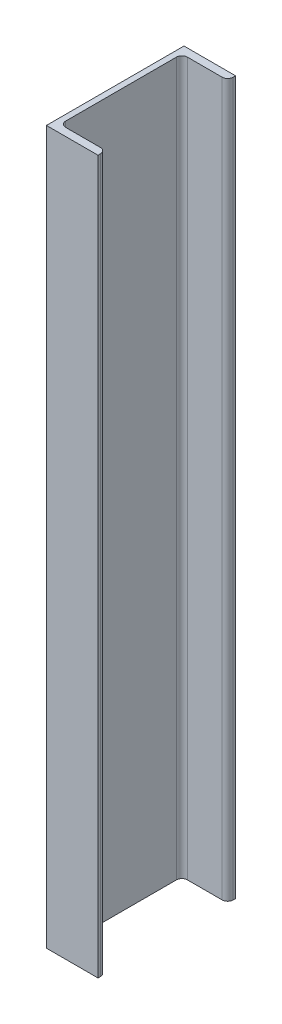
from build123d import *

# Parameters (mm, degrees)
BOSS_EXTRUDE1_DEPTH = 1036


with BuildPart() as part:
    # Sketch1 → Boss-Extrude1 (new body)
    with BuildSketch(Plane(origin=(0, 0, 0), x_dir=(1, 0, 0), z_dir=(0, 1, 0))):
        with BuildLine():
            Line((-38.442622951, 80.983606557), (-113.442622951, 80.983606557))
            Line((-113.442622951, 80.983606557), (-113.442622951, -119.016393443))
            Line((-113.442622951, -119.016393443), (-38.442622951, -119.016393443))
            Line((-38.442622951, -119.016393443), (-38.442622951, -115.516393443))
            ThreePointArc((-38.442622951, -115.516393443), (-40.785768701, -109.859539193), (-46.442622951, -107.516393443))
            Line((-46.442622951, -107.516393443), (-96.942622951, -107.516393443))
            ThreePointArc((-96.942622951, -107.516393443), (-102.5994772, -105.173247692), (-104.942622951, -99.516393443))
            Line((-104.942622951, -99.516393443), (-104.942622951, 61.483606557))
            ThreePointArc((-104.942622951, 61.483606557), (-102.5994772, 67.140460807), (-96.942622951, 69.483606557))
            Line((-96.942622951, 69.483606557), (-46.442622951, 69.483606557))
            ThreePointArc((-46.442622951, 69.483606557), (-40.785768701, 71.826752308), (-38.442622951, 77.483606557))
            Line((-38.442622951, 77.483606557), (-38.442622951, 80.983606557))
        make_face()
    extrude(amount=BOSS_EXTRUDE1_DEPTH)


solid = part.part
